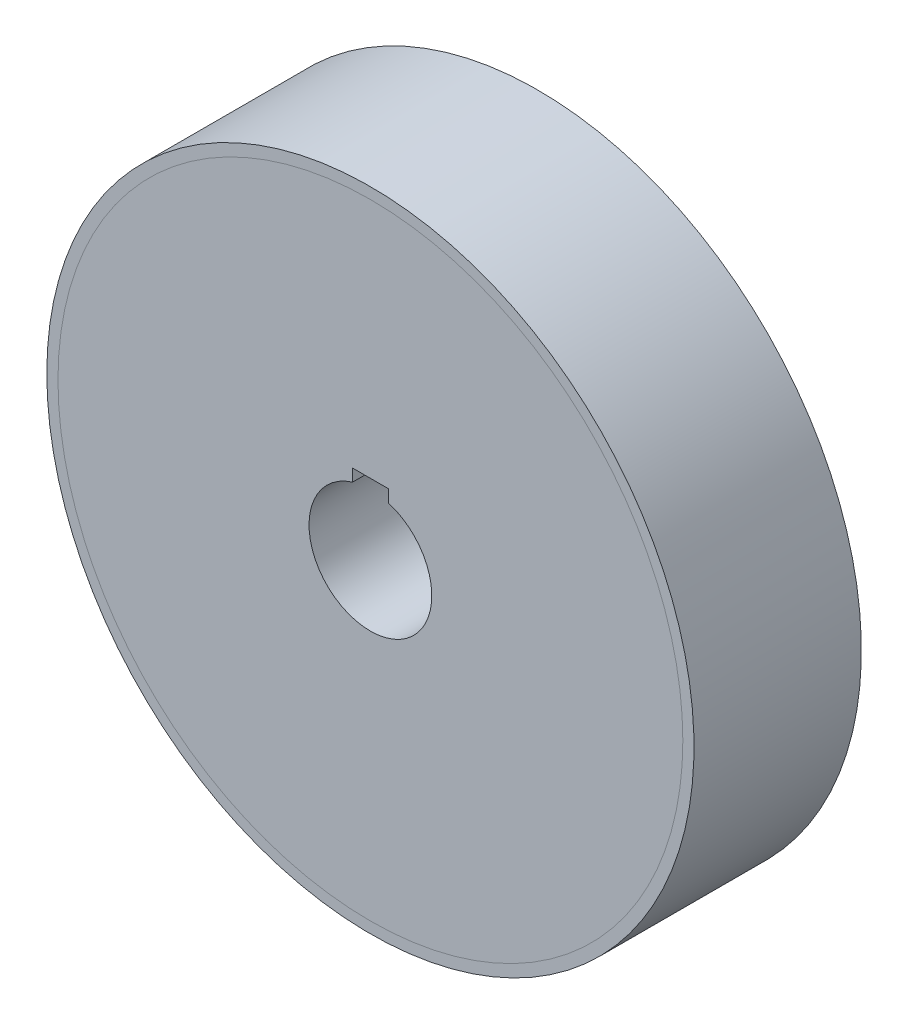
from build123d import *

# Parameters (mm, degrees)
SKETCH1_R           = 140
BOSS_EXTRUDE1_DEPTH = 75
SKETCH2_R           = 27.5
CUT_EXTRUDE1_DEPTH  = 212.719153597
CUT_EXTRUDE2_DEPTH  = 212.719153597
SKETCH4_R           = 145
SKETCH4_R_2         = 140
BOSS_EXTRUDE2_DEPTH = 75


with BuildPart() as part:
    # Sketch1 → Boss-Extrude1 (new body)
    with BuildSketch(Plane.XY):
        Circle(SKETCH1_R)
    extrude(amount=BOSS_EXTRUDE1_DEPTH)

    # Sketch2 → Cut-Extrude1 (cut, through all)
    with BuildSketch(Plane(origin=(0, 0, 0), x_dir=(-1, 0, 0), z_dir=(0, 0, -1))):
        Circle(SKETCH2_R)
    extrude(amount=-CUT_EXTRUDE1_DEPTH, mode=Mode.SUBTRACT)

    # Sketch3 → Cut-Extrude2 (cut, through all)
    with BuildSketch(Plane(origin=(0, 0, 0), x_dir=(-1, 0, 0), z_dir=(0, 0, -1))):
        with BuildLine():
            Line((-8, 26.310644234), (-8, 31.8))
            Line((-8, 31.8), (8, 31.8))
            Line((8, 31.8), (8, 26.310644234))
            ThreePointArc((8, 26.310644234), (0, 27.5), (-8, 26.310644234))
        make_face()
    extrude(amount=-CUT_EXTRUDE2_DEPTH, mode=Mode.SUBTRACT)


with BuildPart() as body_2:
    # Sketch4 → Boss-Extrude2 (new body)
    with BuildSketch(Plane(origin=(0, 0, 0), x_dir=(-1, 0, 0), z_dir=(0, 0, -1))):
        Circle(SKETCH4_R)
        Circle(SKETCH4_R_2, mode=Mode.SUBTRACT)
    extrude(amount=-BOSS_EXTRUDE2_DEPTH)


solid = Compound([part.part, body_2.part])
